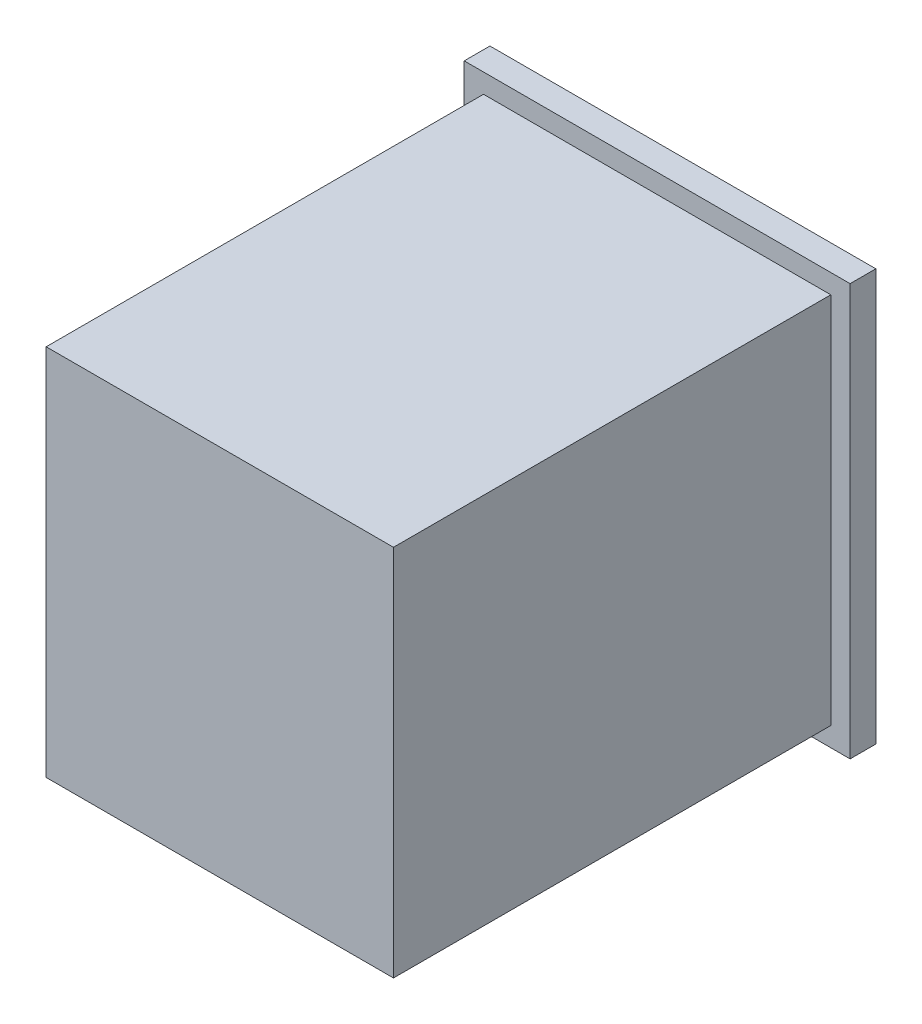
from build123d import *

# Parameters (mm, degrees)
SKETCH1_W           = 13.5
SKETCH1_H           = 14.5
BOSS_EXTRUDE1_DEPTH = 17
SKETCH2_W           = 15
SKETCH2_H           = 16
BOSS_EXTRUDE2_DEPTH = 1
SKETCH3_W           = 12
SKETCH3_H           = 4.5
CUT_EXTRUDE1_DEPTH  = 10


with BuildPart() as part:
    # Sketch1 → Boss-Extrude1 (new body)
    with BuildSketch(Plane.XY):
        Rectangle(SKETCH1_W, SKETCH1_H)
    extrude(amount=BOSS_EXTRUDE1_DEPTH)

    # Sketch2 → Boss-Extrude2 (add)
    with BuildSketch(Plane.XY):
        Rectangle(SKETCH2_W, SKETCH2_H)
    extrude(amount=-BOSS_EXTRUDE2_DEPTH)

    # Sketch3 → Cut-Extrude1 (cut)
    with BuildSketch(Plane(origin=(0, 0, -1), x_dir=(-1, 0, 0), z_dir=(0, 0, -1))):
        with Locations((0, 4)):
            Rectangle(SKETCH3_W, SKETCH3_H)
        with Locations((0, -4)):
            Rectangle(SKETCH3_W, SKETCH3_H)
    extrude(amount=-CUT_EXTRUDE1_DEPTH, mode=Mode.SUBTRACT)


solid = part.part
